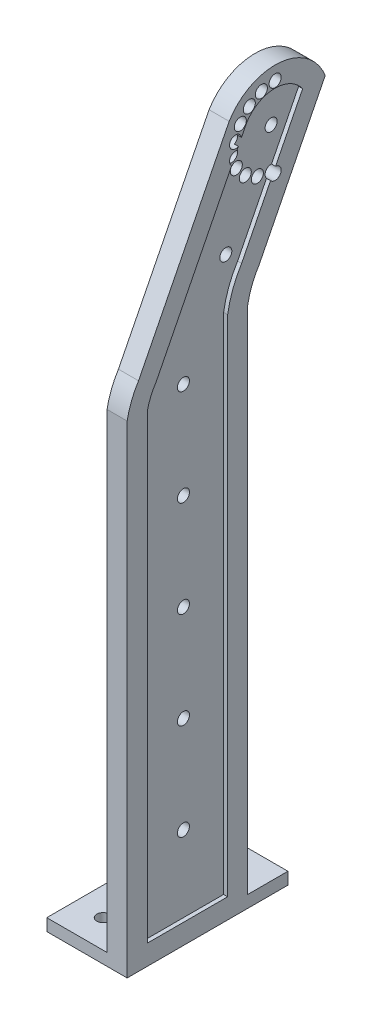
from build123d import *

# Parameters (mm, degrees)
SKETCH_1_R          = 1.5
EXTRUDE_2_DEPTH     = 5
CUT_EXTRUDE_1_DEPTH = 1
SKETCH_5_W          = 20
SKETCH_5_H          = 40
EXTRUDE_3_DEPTH     = 3
SKETCH_6_R          = 1.55
CUT_EXTRUDE_2_DEPTH = 10


with BuildPart() as part:
    # 草图1 → 凸台-拉伸2 (new body)
    with BuildSketch(Plane(origin=(0, 0, 0), x_dir=(0, 0, -1), z_dir=(1, 0, 0))):
        with BuildLine():
            Line((-15, 0), (15, 0))
            Line((15, 0), (15, 130))
            ThreePointArc((15, 130), (16.060667235, 133.763397528), (17.833287426, 137.248507798))
            Line((17.833287426, 137.248507798), (34.277601095, 169.80605943))
            ThreePointArc((34.277601095, 169.80605943), (22.969406924, 178.256928012), (10.37531975, 171.878730504))
            Line((10.37531975, 171.878730504), (-12.166712574, 127.248507798))
            ThreePointArc((-12.166712574, 127.248507798), (-13.939332765, 123.763397528), (-15, 120))
            Line((-15, 120), (-15, 0))
        make_face()
        with Locations((0, 23.934052351)):
            Circle(SKETCH_1_R, mode=Mode.SUBTRACT)
        with Locations((0, 47.934052351)):
            Circle(SKETCH_1_R, mode=Mode.SUBTRACT)
        with Locations((0, 71.934052351)):
            Circle(SKETCH_1_R, mode=Mode.SUBTRACT)
        with Locations((0, 95.934052351)):
            Circle(SKETCH_1_R, mode=Mode.SUBTRACT)
        with Locations((10.541707006, 142.602806473)):
            Circle(SKETCH_1_R, mode=Mode.SUBTRACT)
        with Locations((0, 119.934052351)):
            Circle(SKETCH_1_R, mode=Mode.SUBTRACT)
        with Locations((21.812723168, 164.917917825)):
            Circle(SKETCH_1_R, mode=Mode.SUBTRACT)
        with Locations((11.964645637, 166.654399602)):
            Circle(SKETCH_1_R, mode=Mode.SUBTRACT)
        with Locations((11.964645637, 163.181436049)):
            Circle(SKETCH_1_R, mode=Mode.SUBTRACT)
        with Locations((13.15246913, 159.917917825)):
            Circle(SKETCH_1_R, mode=Mode.SUBTRACT)
        with Locations((15.384847071, 157.257473394)):
            Circle(SKETCH_1_R, mode=Mode.SUBTRACT)
        with Locations((18.392521734, 155.520991617)):
            Circle(SKETCH_1_R, mode=Mode.SUBTRACT)
        with Locations((21.812723168, 154.917917825)):
            Circle(SKETCH_1_R, mode=Mode.SUBTRACT)
        with Locations((13.15246913, 169.917917825)):
            Circle(SKETCH_1_R, mode=Mode.SUBTRACT)
        with Locations((15.384847071, 172.578362256)):
            Circle(SKETCH_1_R, mode=Mode.SUBTRACT)
        with Locations((18.392521734, 174.314844033)):
            Circle(SKETCH_1_R, mode=Mode.SUBTRACT)
        with Locations((21.812723168, 174.917917825)):
            Circle(SKETCH_1_R, mode=Mode.SUBTRACT)
    extrude(amount=-EXTRUDE_2_DEPTH)

    # 草图4 → 切除-拉伸1 (cut)
    with BuildSketch(Plane(origin=(0, 0, 0), x_dir=(0, 0, -1), z_dir=(1, 0, 0))):
        with BuildLine():
            Line((-10, 5), (10, 5))
            Line((10, 5), (10, 130.418298195))
            ThreePointArc((10, 130.418298195), (11.272736422, 135.241025308), (13.477541954, 139.715104809))
            Line((13.477541954, 139.715104809), (28.657153069, 169.768713769))
            ThreePointArc((28.657153069, 169.768713769), (21.607154469, 173.304465594), (14.73885303, 169.427552317))
            Line((14.73885303, 169.427552317), (-7.82549521, 124.753147068))
            ThreePointArc((-7.82549521, 124.753147068), (-9.161705076, 122.242477333), (-10, 119.524724411))
            Line((-10, 119.524724411), (-10, 5))
        make_face()
    extrude(amount=-CUT_EXTRUDE_1_DEPTH, mode=Mode.SUBTRACT)

    # 草图5 → 凸台-拉伸3 (add)
    with BuildSketch(Plane(origin=(0, 0, 0), x_dir=(-1, 0, 0), z_dir=(0, -1, 0))):
        with Locations((10, 5)):
            Rectangle(SKETCH_5_W, SKETCH_5_H)
    extrude(amount=-EXTRUDE_3_DEPTH)

    # 草图6 → 切除-拉伸2 (cut)
    with BuildSketch(Plane.XZ):
        with Locations(Location((-13, -18, 0), (0, 0, 270))):
            Circle(SKETCH_6_R)
        with Locations(Location((-13, 8, 0), (0, 0, 270))):
            Circle(SKETCH_6_R)
    extrude(amount=-CUT_EXTRUDE_2_DEPTH, mode=Mode.SUBTRACT)


solid = part.part
